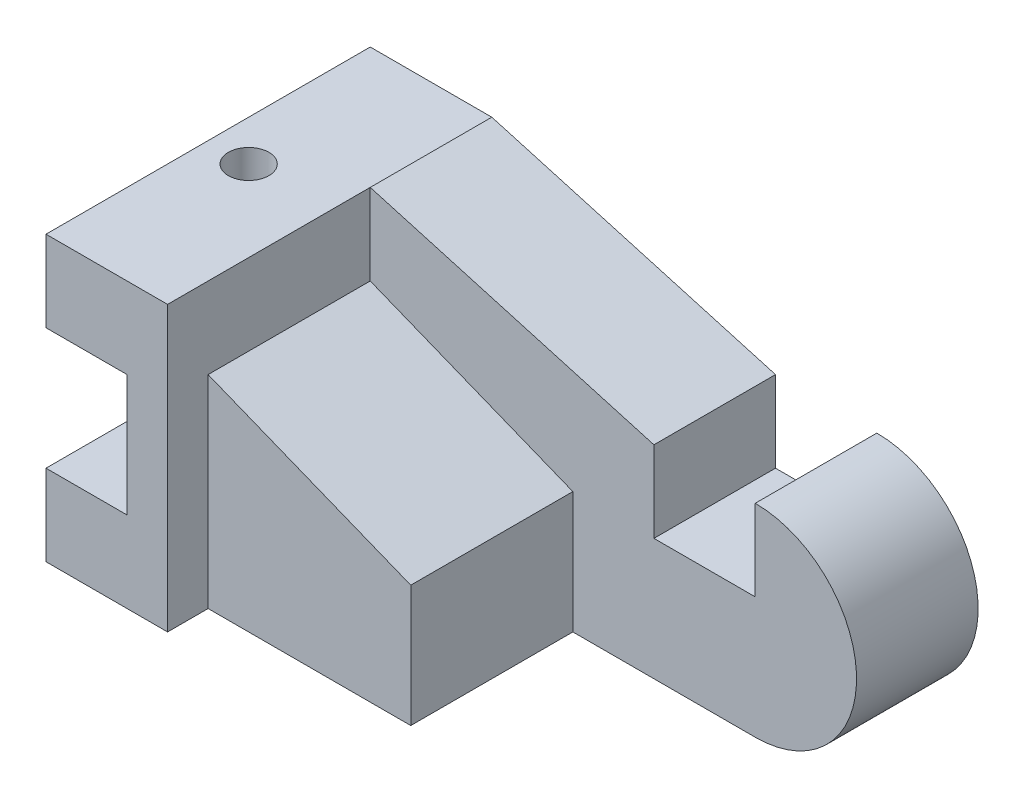
from build123d import *

# Parameters (mm, degrees)
BOSS_EXTRUDE1_DEPTH        = 40
BOSS_EXTRUDE2_START        = -40
BOSS_EXTRUDE2_DEPTH        = 30
BOSS_EXTRUDE3_DEPTH        = 40
F_10_0MM_DOWEL_HOLE1_D     = 10
F_10_0MM_DOWEL_HOLE1_DEPTH = 20


with BuildPart() as part:
    # Sketch1 → Boss-Extrude1 (new, symmetric)
    with BuildSketch(Plane.XY):
        Polygon((0, 0), (0, 70), (-30, 70), (-30, 50), (-10, 50), (-10, 20), (-30, 20), (-30, 0), align=None)
    extrude(amount=BOSS_EXTRUDE1_DEPTH, both=True)

    # Sketch1<3> → Boss-Extrude2 (add)
    with BuildSketch(Plane.XY.offset(BOSS_EXTRUDE2_START)):
        Polygon((0, 70), (-30, 70), (-30, 50), (-10, 50), (-10, 20), (-30, 20), (-30, 0), (0, 0), align=None)
        with BuildLine():
            Line((70, 50), (0, 70))
            Line((0, 70), (0, 0))
            Line((0, 0), (95, 0))
            ThreePointArc((95, 0), (120, 25), (95, 50))
            Line((95, 50), (95, 30))
            Line((95, 30), (70, 30))
            Line((70, 30), (70, 50))
        make_face()
    extrude(amount=BOSS_EXTRUDE2_DEPTH)

    # Sketch2 → Boss-Extrude3 (add)
    with BuildSketch(Plane.XY.offset(-10)):
        Polygon((0, 50), (0, 0), (50, 0), (50, 30), align=None)
    extrude(amount=BOSS_EXTRUDE3_DEPTH)

    # Ø10.0mm Dowel Hole1
    with Locations(Plane(origin=(0, 70, 0), x_dir=(1, 0, 0), z_dir=(0, 1, 0))):
        with Locations((-20, 0)):
            Hole(F_10_0MM_DOWEL_HOLE1_D / 2, depth=F_10_0MM_DOWEL_HOLE1_DEPTH)


solid = part.part
